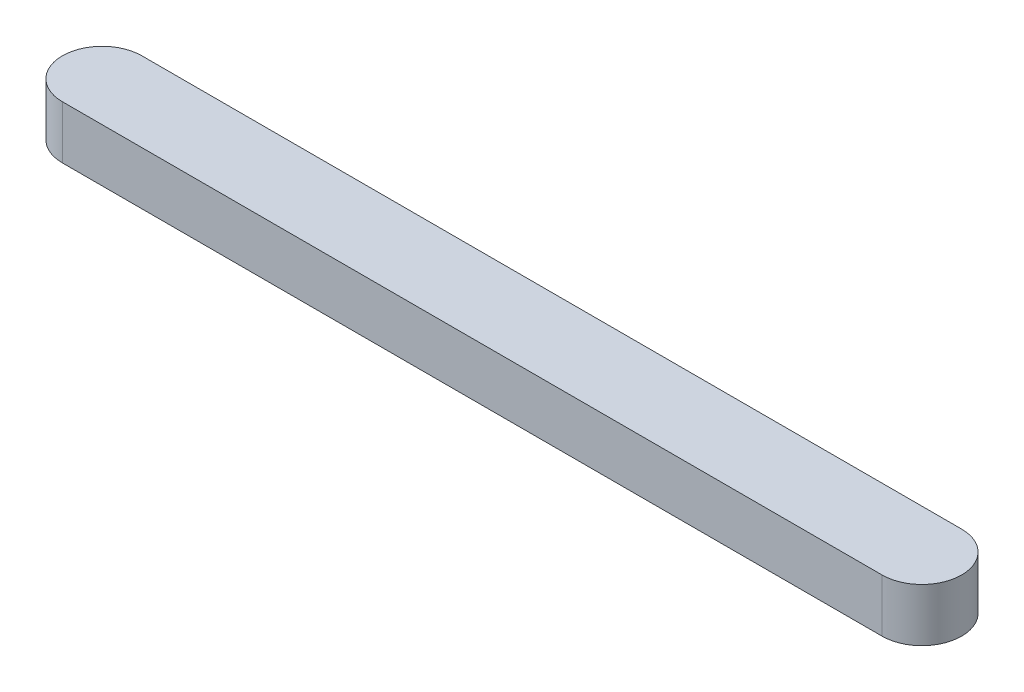
from build123d import *

# Parameters (mm, degrees)
BOSS_EXTRUDE1_DEPTH = 4


with BuildPart() as part:
    # Sketch1 → Boss-Extrude1 (new body)
    with BuildSketch(Plane(origin=(0, 0, 0), x_dir=(1, 0, 0), z_dir=(0, 1, 0))):
        with BuildLine():
            Line((-30.925, 3), (30.925, 3))
            ThreePointArc((30.925, 3), (33.925, 0), (30.925, -3))
            Line((30.925, -3), (-30.925, -3))
            ThreePointArc((-30.925, -3), (-33.925, 0), (-30.925, 3))
        make_face()
    extrude(amount=BOSS_EXTRUDE1_DEPTH)


solid = part.part
